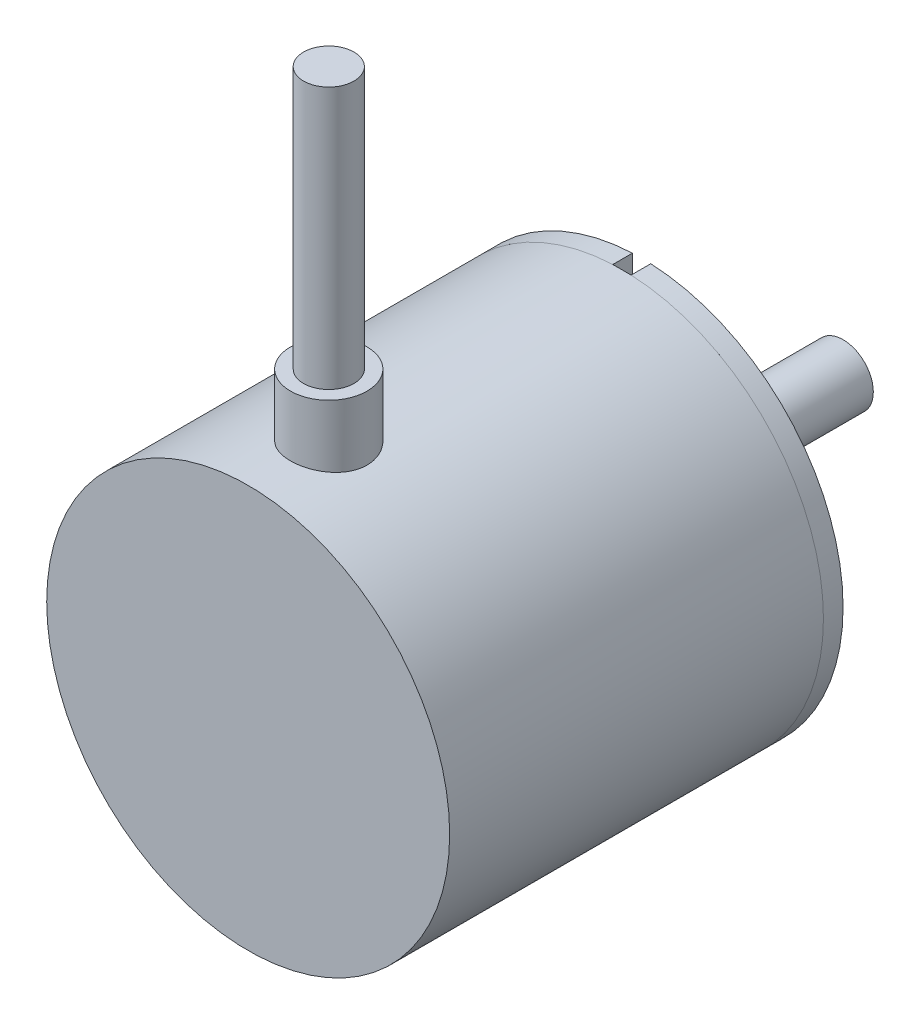
from build123d import *

# Parameters (mm, degrees)
SKETCH1_R           = 20
BOSS_EXTRUDE1_DEPTH = 1.95
SKETCH2_R           = 10
BOSS_EXTRUDE2_DEPTH = 5
SKETCH3_R           = 3
BOSS_EXTRUDE3_DEPTH = 15
SKETCH4_R           = 1
CUT_EXTRUDE1_DEPTH  = 10
CUT_EXTRUDE2_DEPTH  = 2.3
SKETCH6_R           = 20
BOSS_EXTRUDE5_DEPTH = 37.1
SKETCH7_R           = 7.5
CUT_EXTRUDE3_DEPTH  = 0.1
SKETCH9_R           = 3.8
BOSS_EXTRUDE6_DEPTH = 26
SKETCH10_R          = 2.5
BOSS_EXTRUDE7_DEPTH = 26
SKETCH11_W          = 6.12779924
SKETCH11_H          = 1.319674488
CUT_EXTRUDE4_DEPTH  = 9


with BuildPart() as part:
    # Sketch1 → Boss-Extrude1 (new body)
    with BuildSketch(Plane.XY):
        Circle(SKETCH1_R)
    extrude(amount=BOSS_EXTRUDE1_DEPTH)

    # Sketch2 → Boss-Extrude2 (add)
    with BuildSketch(Plane(origin=(0, 0, 0), x_dir=(-1, 0, 0), z_dir=(0, 0, -1))):
        with Locations(Location((0, 0, 0), (0, 0, 180))):
            Circle(SKETCH2_R)
    extrude(amount=BOSS_EXTRUDE2_DEPTH)

    # Sketch3 → Boss-Extrude3 (add)
    with BuildSketch(Plane(origin=(0, 0, -5), x_dir=(-1, 0, 0), z_dir=(0, 0, -1))):
        Circle(SKETCH3_R)
    extrude(amount=BOSS_EXTRUDE3_DEPTH)

    # Sketch4 → Cut-Extrude1 (cut)
    with BuildSketch(Plane(origin=(0, 0, 0), x_dir=(-1, 0, 0), z_dir=(0, 0, -1))):
        with Locations((0, 15)):
            Circle(SKETCH4_R)
        with Locations((12.990381057, -7.5)):
            Circle(SKETCH4_R)
        with Locations((-12.990381057, -7.5)):
            Circle(SKETCH4_R)
    extrude(amount=-CUT_EXTRUDE1_DEPTH, mode=Mode.SUBTRACT)

    # Sketch5 → Cut-Extrude2 (cut)
    with BuildSketch(Plane(origin=(0, 0, 0), x_dir=(-1, 0, 0), z_dir=(0, 0, -1))):
        with BuildLine():
            ThreePointArc((0.91, 19.979286774), (0.455117852, 19.994821023), (0, 20))
            Line((0, 20), (0, 18.079462351))
            Line((0, 18.079462351), (0.91, 18.079462351))
            Line((0.91, 18.079462351), (0.91, 19.979286774))
        make_face()
        with BuildLine():
            Line((0, 18.079462351), (0, 20))
            ThreePointArc((0, 20), (-0.455117852, 19.994821023), (-0.91, 19.979286774))
            Line((-0.91, 19.979286774), (-0.91, 18.079462351))
            Line((-0.91, 18.079462351), (0, 18.079462351))
        make_face()
    extrude(amount=-CUT_EXTRUDE2_DEPTH, mode=Mode.SUBTRACT)

    # Sketch7 → Cut-Extrude3 (cut)
    with BuildSketch(Plane(origin=(0, 0, -5), x_dir=(-1, 0, 0), z_dir=(0, 0, -1))):
        Circle(SKETCH7_R)
    extrude(amount=-CUT_EXTRUDE3_DEPTH, mode=Mode.SUBTRACT)


with BuildPart() as body_2:
    # Sketch6 → Boss-Extrude5 (new body)
    with BuildSketch(Plane.XY.offset(1.95)):
        Circle(SKETCH6_R)
    extrude(amount=BOSS_EXTRUDE5_DEPTH)

    # Sketch9 → Boss-Extrude6 (add)
    with BuildSketch(Plane(origin=(0, 0, 0), x_dir=(1, 0, 0), z_dir=(0, 1, 0))):
        with Locations(Location((0, -31.05, 0), (0, 0, 90))):
            Circle(SKETCH9_R)
    extrude(amount=BOSS_EXTRUDE6_DEPTH)

    # Sketch10 → Boss-Extrude7 (add)
    with BuildSketch(Plane(origin=(0, 26, 0), x_dir=(1, 0, 0), z_dir=(0, 1, 0))):
        with Locations(Location((0, -31.05, 0), (0, 0, 90))):
            Circle(SKETCH10_R)
    extrude(amount=BOSS_EXTRUDE7_DEPTH)


with BuildPart() as cut_extrude3_piece_1:
    # of the separate pieces the step leaves, piece 1, a body of its own (cut_extrude3_pieces)
    add(part.part.solids().sort_by_distance((20, 0, 0))[0])


with BuildPart() as cut_extrude3_piece_2:
    # of the separate pieces the step leaves, piece 2, a body of its own (cut_extrude3_pieces)
    add(part.part.solids().sort_by_distance((-3, 0, -5))[0])

    # Sketch11 → Cut-Extrude4 (cut)
    with BuildSketch(Plane(origin=(0, 0, -20), x_dir=(-1, 0, 0), z_dir=(0, 0, -1))):
        with Locations((0.136461737, -2.659837244)):
            Rectangle(SKETCH11_W, SKETCH11_H)
    extrude(amount=-CUT_EXTRUDE4_DEPTH, mode=Mode.SUBTRACT)


solid = Compound([body_2.part, cut_extrude3_piece_1.part, cut_extrude3_piece_2.part])
